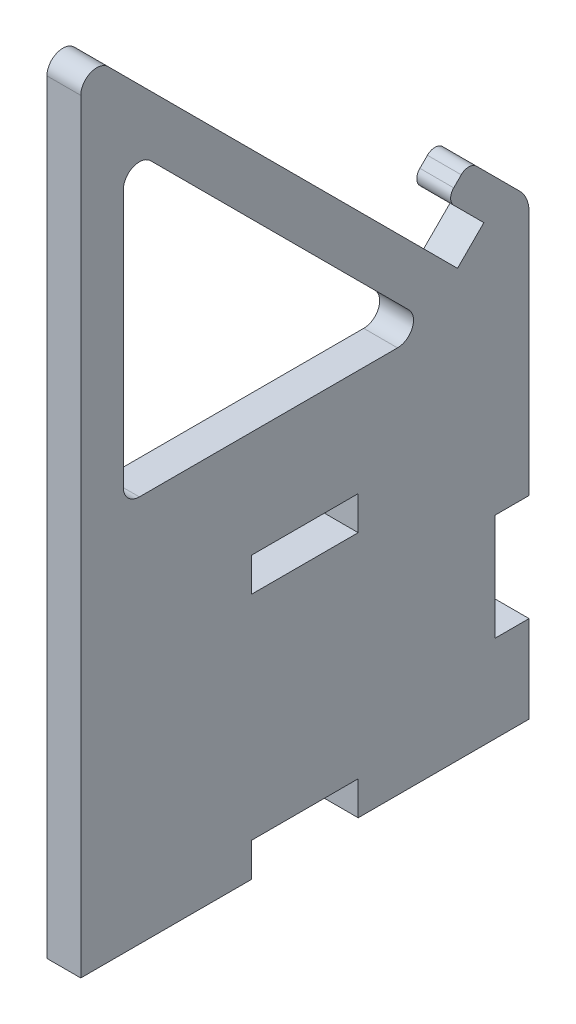
from build123d import *

# Parameters (mm, degrees)
BOSS_EXTRU_1_DEPTH      = 6.35
ESQUISSE2_W             = 20
ESQUISSE2_H             = 6.35
ESQUISSE2_W_2           = 6.35
ESQUISSE2_H_2           = 20
ENL_V_MAT_EXTRU_1_DEPTH = 157.601902923
CONG_1_R                = 6
CONG_2_R                = 2
ENL_V_MAT_EXTRU_2_DEPTH = 157.601902923
CONG_4_R                = 3


with BuildPart() as part:
    # Esquisse1 → Boss.-Extru.1 (new body)
    with BuildSketch(Plane(origin=(0, 0, 0), x_dir=(0, 0, -1), z_dir=(1, 0, 0))):
        Polygon((-42.072853481, 0), (42.072853481, 0), (42.072853481, 84.949747468), (30.759144982, 96.263455967), (26.516504294, 92.02081528), (33.587572106, 84.949747468), (28.637824638, 80), (-42.072853481, 150.710678119), align=None)
    extrude(amount=BOSS_EXTRU_1_DEPTH)

    # Esquisse2 → Enlèv. mat.-Extru.1 (cut, through all)
    with BuildSketch(Plane(origin=(6.35, 0, 0), x_dir=(0, 0, -1), z_dir=(1, 0, 0))):
        with Locations((0, 3.175)):
            Rectangle(ESQUISSE2_W, ESQUISSE2_H)
        with Locations((0, 49.525)):
            Rectangle(ESQUISSE2_W, ESQUISSE2_H)
        with Locations((38.897853481, 26.35)):
            Rectangle(ESQUISSE2_W_2, ESQUISSE2_H_2)
    extrude(amount=-ENL_V_MAT_EXTRU_1_DEPTH, mode=Mode.SUBTRACT)

    # Congé1
    cong_1_edges = [part.edges().sort_by_distance(p)[0] for p in [
        (3.175, 84.949747468, -42.072853481),
    ]]
    fillet(cong_1_edges, radius=CONG_1_R)

    # Congé2
    cong_2_edges = [part.edges().sort_by_distance(p)[0] for p in [
        (3.175, 92.02081528, -26.516504294),
        (3.175, 96.263455967, -30.759144982),
    ]]
    fillet(cong_2_edges, radius=CONG_2_R)

    # Esquisse4 → Enlèv. mat.-Extru.2 (cut, through all)
    with BuildSketch(Plane(origin=(6.35, 0, 0), x_dir=(0, 0, -1), z_dir=(1, 0, 0))):
        Polygon((24.624116139, 72.7), (-34.072853481, 72.7), (-34.072853481, 131.39696962), align=None)
    extrude(amount=-ENL_V_MAT_EXTRU_2_DEPTH, mode=Mode.SUBTRACT)

    # Congé4
    cong_4_edges = [part.edges().sort_by_distance(p)[0] for p in [
        (3.175, 150.710678119, 42.072853481),
        (3.175, 131.39696962, 34.072853481),
        (3.175, 72.7, -24.624116139),
        (3.175, 72.7, 34.072853481),
    ]]
    fillet(cong_4_edges, radius=CONG_4_R)


solid = part.part
